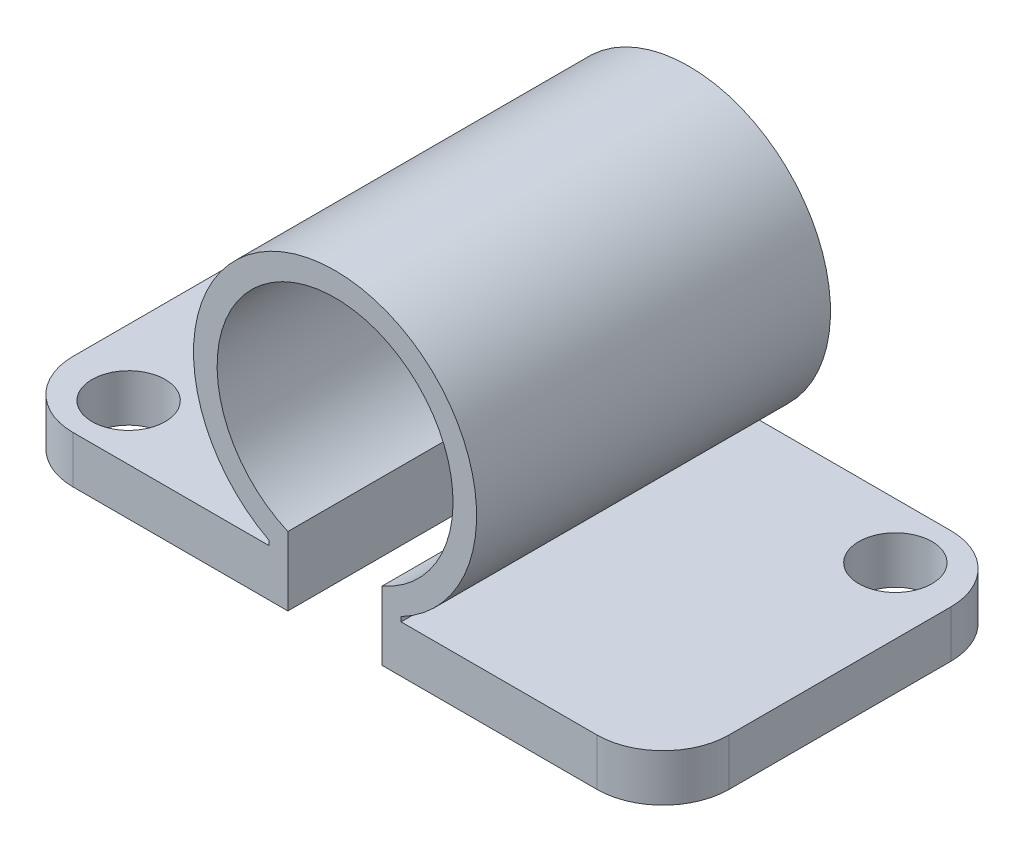
from build123d import *

# Parameters (mm, degrees)
SALIENTE_EXTRUIR2_DEPTH = 15
CROQUIS3_R              = 1.55
SALIENTE_EXTRUIR3_DEPTH = 2


with BuildPart() as part:
    # Croquis2 → Saliente-Extruir2 (new body)
    with BuildSketch(Plane.XY):
        with BuildLine():
            Line((2.8, -5.306599665), (2.8, -5.5))
            Line((2.8, -5.5), (2, -5.5))
            Line((2, -5.5), (2, -4.582575695))
            ThreePointArc((2, -4.582575695), (0, 5), (-2, -4.582575695))
            Line((-2, -4.582575695), (-2, -5.5))
            Line((-2, -5.5), (-2.8, -5.5))
            Line((-2.8, -5.5), (-2.8, -5.306599665))
            ThreePointArc((-2.8, -5.306599665), (0, 6), (2.8, -5.306599665))
        make_face()
    extrude(amount=SALIENTE_EXTRUIR2_DEPTH)

    # Croquis3 → Saliente-Extruir3 (add)
    # profile 1 of 2: a face of its own
    with BuildSketch(Plane.XZ.offset(5.5)):
        with BuildLine():
            Line((2, 0), (2, 15))
            Line((2, 15), (11.1, 15))
            ThreePointArc((11.1, 15), (13.079898987, 14.179898987), (13.9, 12.2))
            Line((13.9, 12.2), (13.9, 2.8))
            ThreePointArc((13.9, 2.8), (13.079898987, 0.820101013), (11.1, 0))
            Line((11.1, 0), (2, 0))
        make_face()
        with Locations(Location((11.1, 2.35, 0), (0, 0, 270))):
            Circle(CROQUIS3_R, mode=Mode.SUBTRACT)
    # profile 2 of 2: a face of its own
    with BuildSketch(Plane.XZ.offset(5.5)):
        with BuildLine():
            Line((-13.9, 2.8), (-13.9, 12.2))
            ThreePointArc((-13.9, 12.2), (-13.079898987, 14.179898987), (-11.1, 15))
            Line((-11.1, 15), (-2, 15))
            Line((-2, 15), (-2, 0))
            Line((-2, 0), (-11.1, 0))
            ThreePointArc((-11.1, 0), (-13.079898987, 0.820101013), (-13.9, 2.8))
        make_face()
        with Locations(Location((-11.1, 12.65, 0), (0, 0, 270))):
            Circle(CROQUIS3_R, mode=Mode.SUBTRACT)
    extrude(amount=SALIENTE_EXTRUIR3_DEPTH)


solid = part.part
